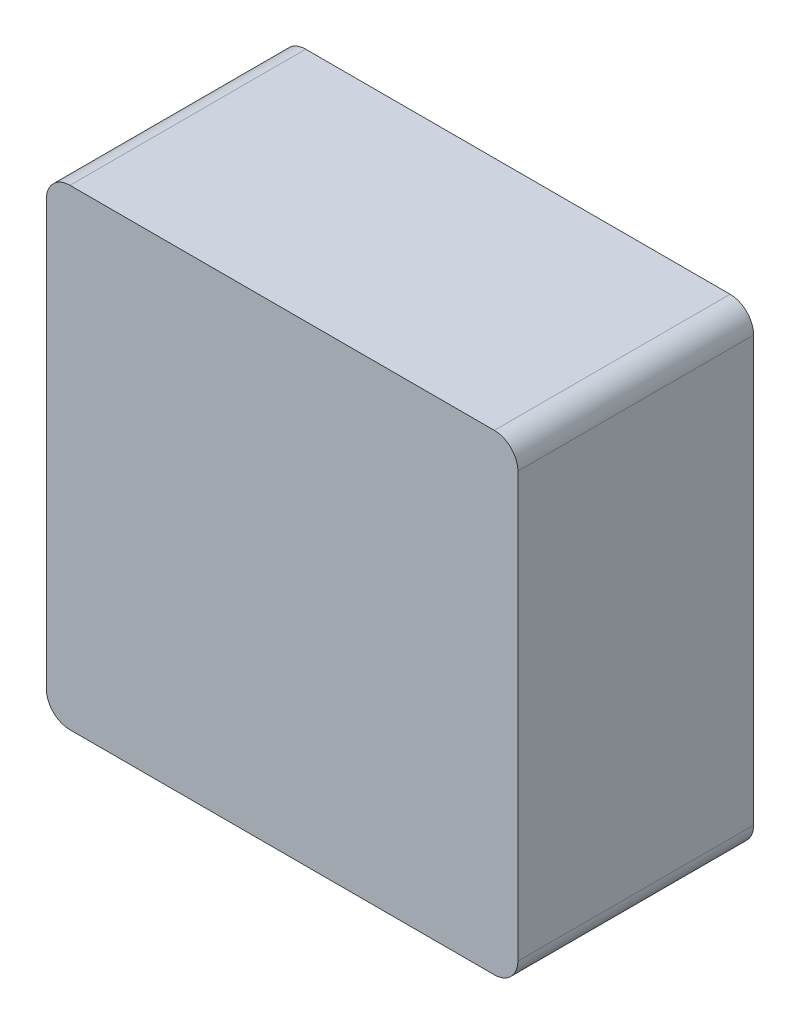
from build123d import *

# Parameters (mm, degrees)
SKETCH_1_R      = 50
EXTRUDE_1_DEPTH = 50
SKETCH_2_W      = 200
SKETCH_2_H      = 200
EXTRUDE_2_DEPTH = 100
FILLET_1_R      = 10


with BuildPart() as part:
    # 草图1 → 凸台-拉伸1 (new body)
    with BuildSketch(Plane.XY):
        Circle(SKETCH_1_R)
    extrude(amount=EXTRUDE_1_DEPTH)

    # 草图2 → 凸台-拉伸2 (add)
    with BuildSketch(Plane.XY.offset(50)):
        Rectangle(SKETCH_2_W, SKETCH_2_H)
    extrude(amount=EXTRUDE_2_DEPTH)

    # 圆角1
    fillet_1_edges = [part.edges().sort_by_distance(p)[0] for p in [
        (-50, 0, 0),
        (-50, 0, 50),
        (-100, 100, 100),
        (-100, -100, 100),
        (100, -100, 100),
        (100, 100, 100),
    ]]
    fillet(fillet_1_edges, radius=FILLET_1_R)


solid = part.part
